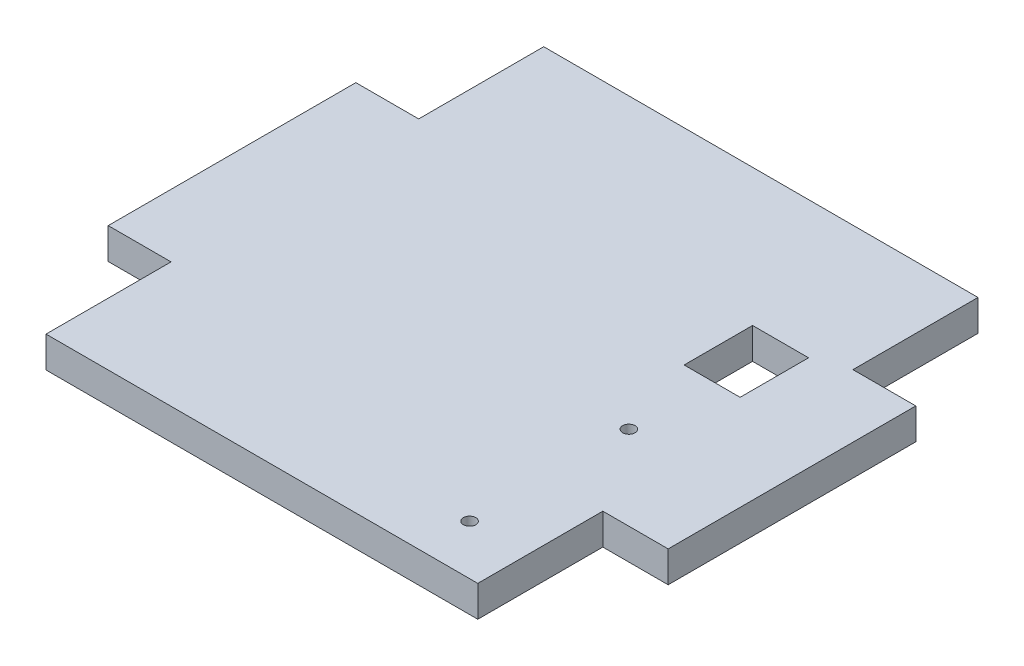
from build123d import *

# Parameters (mm, degrees)
BOSS_EXTRUDE1_DEPTH     = 50
CUT_EXTRUDE1_DEPTH      = 731.807873314
CUT_EXTRUDE1_DEPTH_BACK = 731.807873314
SKETCH2_R               = 10
SKETCH2_W               = 90
SKETCH2_H               = 110


with BuildPart() as part:
    # Sketch1 → Boss-Extrude1 (new body)
    with BuildSketch(Plane(origin=(0, 0, 0), x_dir=(1, 0, 0), z_dir=(0, 1, 0))):
        Polygon((-424.861111111, 294.975010995), (273.138888889, 294.975010995), (273.138888889, 93.975010995), (374.138888889, 93.975010995), (374.138888889, -304.024989005), (269.138888889, -304.024989005), (269.138888889, -505.024989005), (-424.861111111, -505.024989005), (-424.861111111, -304.024989005), (-525.861111111, -304.024989005), (-525.861111111, 93.975010995), (-424.861111111, 93.975010995), align=None)
    extrude(amount=BOSS_EXTRUDE1_DEPTH)

    # Sketch2 → Cut-Extrude1 (cut, two sides: drawn at the far end of the back side and taken through both)
    with BuildSketch(Plane(origin=(0, 50, 0), x_dir=(1, 0, 0), z_dir=(0, 1, 0)).offset(-CUT_EXTRUDE1_DEPTH_BACK)):
        with Locations((175.982294355, -425.024989005)):
            Circle(SKETCH2_R)
        with Locations((175.982294355, -169.024989005)):
            Circle(SKETCH2_R)
        with Locations((175.982294355, 19.807706647)):
            Rectangle(SKETCH2_W, SKETCH2_H)
    extrude(amount=CUT_EXTRUDE1_DEPTH + CUT_EXTRUDE1_DEPTH_BACK, mode=Mode.SUBTRACT)


solid = part.part
